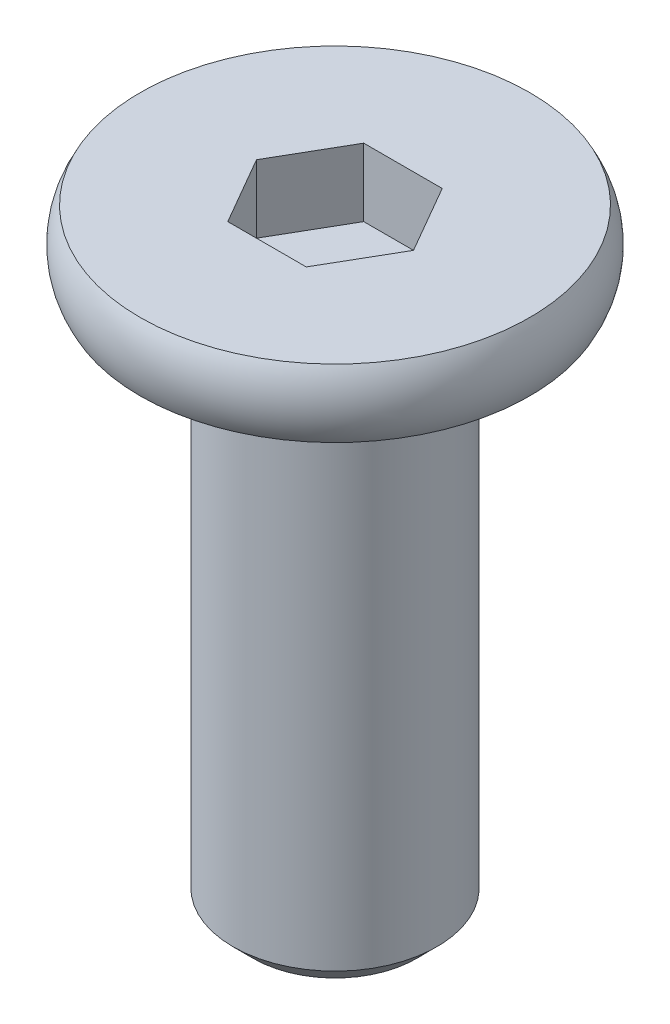
from build123d import *

# Parameters (mm, degrees)
CHAMFER_1_SIZE      = 0.3
CUT_EXTRUDE_1_DEPTH = 1


with BuildPart() as part:
    # 草图1 → 旋转1 (revolve)
    with BuildSketch(Plane.XY, mode=Mode.PRIVATE) as revolve_1_sk:
        with BuildLine():
            Line((0, 0), (2.866025404, 0))
            ThreePointArc((2.866025404, 0), (3, -0.5), (2.866025404, -1))
            Line((2.866025404, -1), (1.5, -1))
            Line((1.5, -1), (1.5, -9))
            Line((1.5, -9), (0, -9))
            Line((0, -9), (0, 0))
        make_face()
    revolve(revolve_1_sk.sketch.rotate(Axis((0, 0, 0), (0, -1, 0)), 90), axis=Axis((0, 0, 0), (0, -1, 0)))

    # 倒角1
    chamfer_1_edges = [part.edges().sort_by_distance(p)[0] for p in [
        (0, -9, -1.5),
    ]]
    chamfer(chamfer_1_edges, length=CHAMFER_1_SIZE)

    # 草图2 → 切除-拉伸1 (cut)
    with BuildSketch(Plane(origin=(0, 0, 0), x_dir=(1, 0, 0), z_dir=(0, 1, 0))):
        Polygon((1.154700538, 0), (0.577350269, 1), (-0.577350269, 1), (-1.154700538, 0), (-0.577350269, -1), (0.577350269, -1), align=None)
    extrude(amount=-CUT_EXTRUDE_1_DEPTH, mode=Mode.SUBTRACT)


solid = part.part
